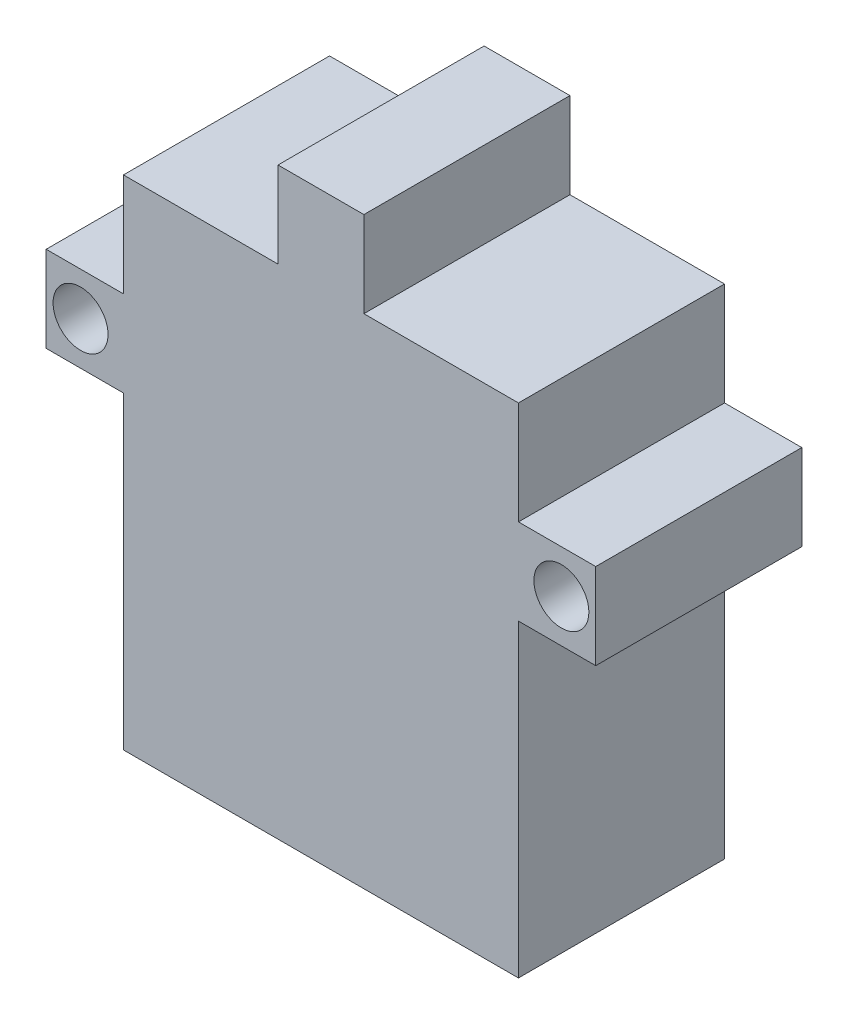
from build123d import *

# Parameters (mm, degrees)
SKETCH_1_R      = 1.6
EXTRUDE_1_DEPTH = 6


with BuildPart() as part:
    # 草图1 → 凸台-拉伸1 (new, symmetric)
    with BuildSketch(Plane.XY):
        Polygon((11.5, 0), (11.5, 18), (16, 18), (16, 23), (11.5, 23), (11.5, 29), (2.5, 29), (2.5, 34), (-2.5, 34), (-2.5, 29), (-11.5, 29), (-11.5, 23), (-16, 23), (-16, 18), (-11.5, 18), (-11.5, 0), align=None)
        with Locations((14, 20.5)):
            Circle(SKETCH_1_R, mode=Mode.SUBTRACT)
        with Locations((-14, 20.5)):
            Circle(SKETCH_1_R, mode=Mode.SUBTRACT)
    extrude(amount=EXTRUDE_1_DEPTH, both=True)


solid = part.part
